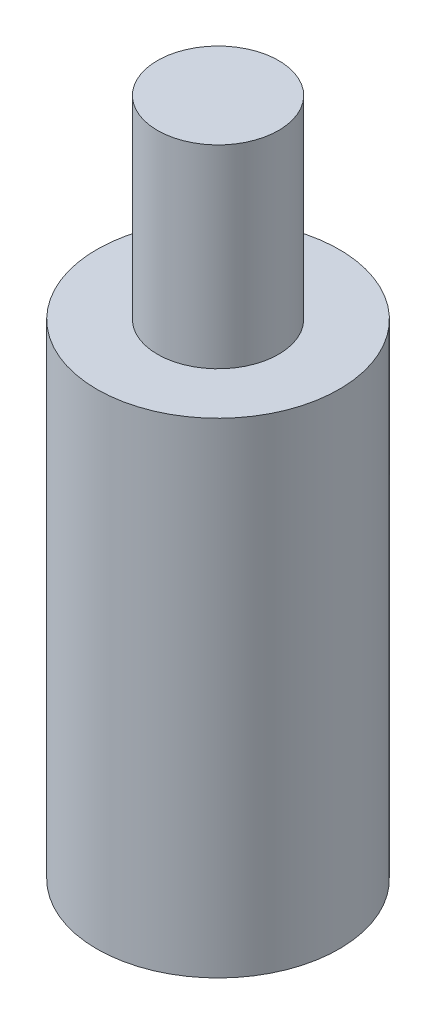
from build123d import *

# Parameters (mm, degrees)
SKETCH3_R           = 3.175
BOSS_EXTRUDE3_DEPTH = 12.7
SKETCH4_R           = 1.5875
BOSS_EXTRUDE4_DEPTH = 5.08


with BuildPart() as part:
    # Sketch3 → Boss-Extrude3 (new body)
    with BuildSketch(Plane(origin=(0, 0, 0), x_dir=(1, 0, 0), z_dir=(0, 1, 0))):
        with Locations(Location((0, 0, 0), (0, 0, 270))):
            Circle(SKETCH3_R)
    extrude(amount=BOSS_EXTRUDE3_DEPTH)

    # Sketch4 → Boss-Extrude4 (add)
    with BuildSketch(Plane(origin=(0, 12.7, 0), x_dir=(1, 0, 0), z_dir=(0, 1, 0))):
        with Locations(Location((0, 0, 0), (0, 0, 270))):
            Circle(SKETCH4_R)
    extrude(amount=BOSS_EXTRUDE4_DEPTH)


solid = part.part
